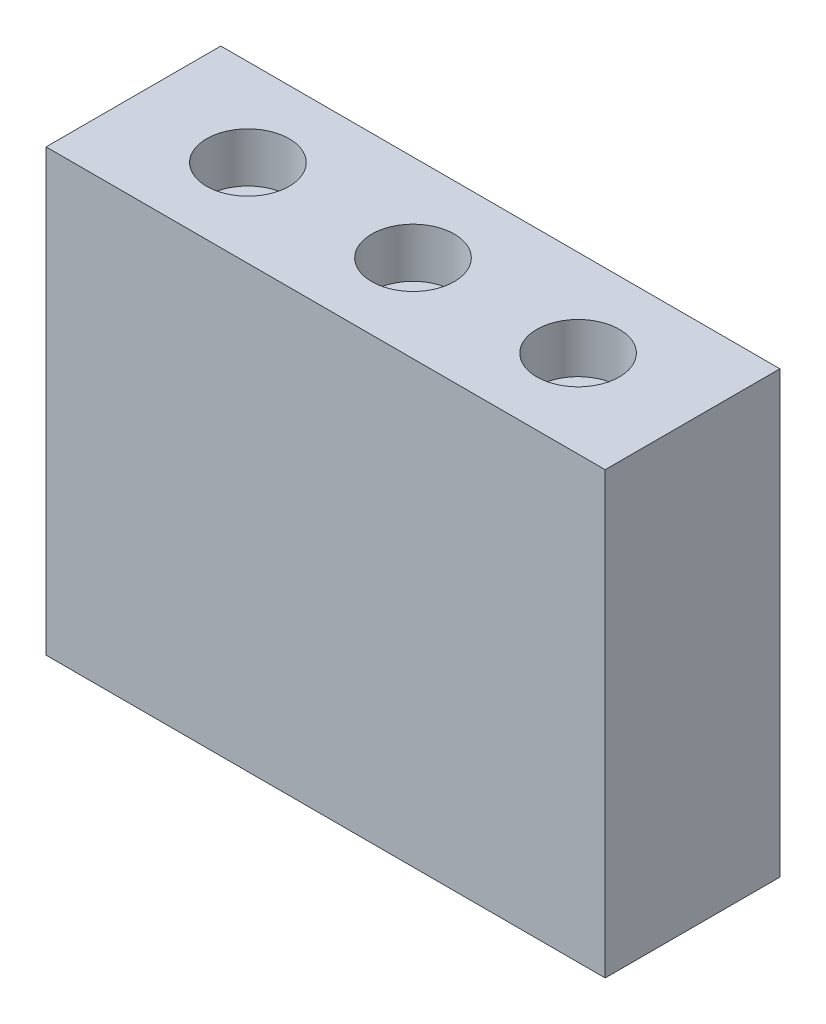
from build123d import *

# Parameters (mm, degrees)
SKETCH1_W                                           = 101.6
SKETCH1_H                                           = 82.55
BOSS_EXTRUDE1_DEPTH                                 = 15.875
SKETCH2_W                                           = 101.6
SKETCH2_H                                           = 2.55
CUT_EXTRUDE1_DEPTH                                  = 100.943496537
CBORE_FOR_M8_HEX_SOCKET_HEAD_CAP_SCREW1_D           = 9
CBORE_FOR_M8_HEX_SOCKET_HEAD_CAP_SCREW1_CBORE_D     = 15
CBORE_FOR_M8_HEX_SOCKET_HEAD_CAP_SCREW1_CBORE_DEPTH = 9


with BuildPart() as part:
    # Sketch1 → Boss-Extrude1 (new, symmetric)
    with BuildSketch(Plane.XY):
        with Locations((0, 38.725)):
            Rectangle(SKETCH1_W, SKETCH1_H)
    extrude(amount=BOSS_EXTRUDE1_DEPTH, both=True)

    # Sketch2 → Cut-Extrude1 (cut, through all)
    with BuildSketch(Plane.XY.offset(15.875)):
        with Locations((0, -1.275)):
            Rectangle(SKETCH2_W, SKETCH2_H)
    extrude(amount=-CUT_EXTRUDE1_DEPTH, mode=Mode.SUBTRACT)

    # CBORE for M8 Hex Socket Head Cap Screw1 (through all)
    with Locations(Plane(origin=(0, 80, 0), x_dir=(1, 0, 0), z_dir=(0, 1, 0))):
        with Locations((30, 0), (0, 0), (-30, 0)):
            CounterBoreHole(CBORE_FOR_M8_HEX_SOCKET_HEAD_CAP_SCREW1_D / 2, CBORE_FOR_M8_HEX_SOCKET_HEAD_CAP_SCREW1_CBORE_D / 2, CBORE_FOR_M8_HEX_SOCKET_HEAD_CAP_SCREW1_CBORE_DEPTH)


solid = part.part
